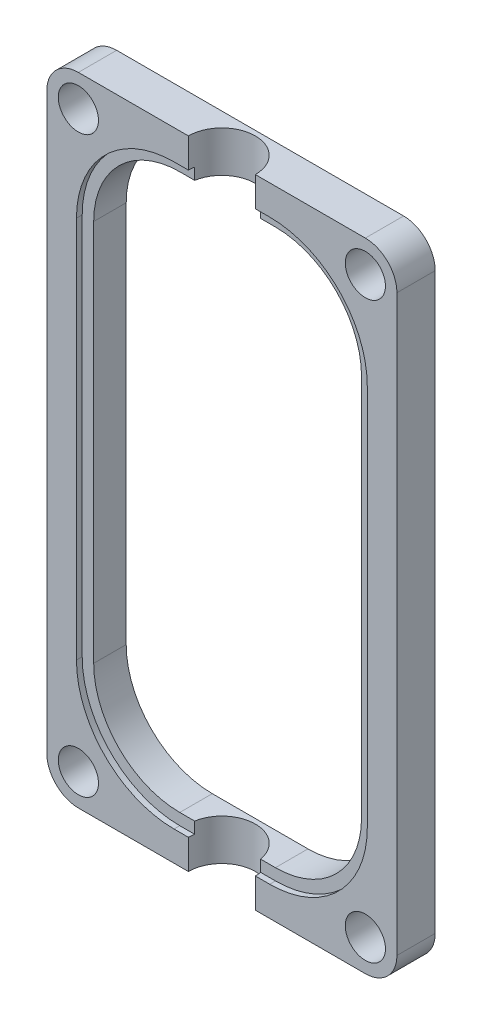
from build123d import *

# Parameters (mm, degrees)
SKIZZE1_R                       = 1.05
AUFSATZ_LINEAR_AUSTRAGEN1_DEPTH = 2
SCHNITT_LINEAR_AUSTRAGEN1_DEPTH = 0.3
SCHNITT_LINEAR_AUSTRAGEN2_REACH = 36.592


with BuildPart() as part:
    # Skizze1 → Aufsatz-Linear austragen1 (new body)
    with BuildSketch(Plane(origin=(0, 0, 0), x_dir=(0, 1, 0), z_dir=(0, 0, 1))):
        with BuildLine():
            Line((-16.65, 7.5), (-16.65, -7.5))
            ThreePointArc((-16.65, -7.5), (-16.166726189, -8.666726189), (-15, -9.15))
            Line((-15, -9.15), (15, -9.15))
            ThreePointArc((15, -9.15), (16.166726189, -8.666726189), (16.65, -7.5))
            Line((16.65, -7.5), (16.65, 7.5))
            ThreePointArc((16.65, 7.5), (16.166726189, 8.666726189), (15, 9.15))
            Line((15, 9.15), (-15, 9.15))
            ThreePointArc((-15, 9.15), (-16.166726189, 8.666726189), (-16.65, 7.5))
        make_face()
        with Locations(Location((-15, 7.5, 0), (0, 0, 270))):
            Circle(SKIZZE1_R, mode=Mode.SUBTRACT)
        with Locations(Location((15, 7.5, 0), (0, 0, 270))):
            Circle(SKIZZE1_R, mode=Mode.SUBTRACT)
        with Locations(Location((15, -7.5, 0), (0, 0, 270))):
            Circle(SKIZZE1_R, mode=Mode.SUBTRACT)
        with Locations(Location((-15, -7.5, 0), (0, 0, 270))):
            Circle(SKIZZE1_R, mode=Mode.SUBTRACT)
        with BuildLine():
            Line((-14.5, 2.5), (-14.5, -2.5))
            ThreePointArc((-14.5, -2.5), (-13.181980515, -5.681980515), (-10, -7))
            Line((-10, -7), (10, -7))
            ThreePointArc((10, -7), (13.181980515, -5.681980515), (14.5, -2.5))
            Line((14.5, -2.5), (14.5, 2.5))
            ThreePointArc((14.5, 2.5), (13.181980515, 5.681980515), (10, 7))
            Line((10, 7), (-10, 7))
            ThreePointArc((-10, 7), (-13.181980515, 5.681980515), (-14.5, 2.5))
        make_face(mode=Mode.SUBTRACT)
    extrude(amount=AUFSATZ_LINEAR_AUSTRAGEN1_DEPTH)

    # Skizze2 → Schnitt-Linear austragen1 (cut)
    with BuildSketch(Plane.XY.offset(2)):
        with BuildLine():
            Line((-2.5, -15.1), (2.5, -15.1))
            ThreePointArc((2.5, -15.1), (6.106244584, -13.606244584), (7.6, -10))
            Line((7.6, -10), (7.6, 10))
            ThreePointArc((7.6, 10), (6.106244584, 13.606244584), (2.5, 15.1))
            Line((2.5, 15.1), (-2.5, 15.1))
            ThreePointArc((-2.5, 15.1), (-6.106244584, 13.606244584), (-7.6, 10))
            Line((-7.6, 10), (-7.6, -10))
            ThreePointArc((-7.6, -10), (-6.106244584, -13.606244584), (-2.5, -15.1))
        make_face()
    extrude(amount=-SCHNITT_LINEAR_AUSTRAGEN1_DEPTH, mode=Mode.SUBTRACT)

    # Schnitt-Linear austragen2: up to this face of the body (flat: up to its plane)
    schnitt_linear_austragen2_end = Plane(part.part.faces().sort_by_distance((0, 16.65, 1))[0])
    # Skizze3 → Schnitt-Linear austragen2 (cut, up to the picked face)
    with BuildSketch(Plane.XZ.offset(16.65), mode=Mode.PRIVATE) as schnitt_linear_austragen2_sk1:
        with BuildLine():
            Line((-1.75, 2), (1.75, 2))
            ThreePointArc((1.75, 2), (0, 0.25), (-1.75, 2))
        make_face()
    schnitt_linear_austragen2_tool1 = split(extrude(schnitt_linear_austragen2_sk1.sketch, amount=-SCHNITT_LINEAR_AUSTRAGEN2_REACH, mode=Mode.PRIVATE), bisect_by=schnitt_linear_austragen2_end, keep=Keep.BOTH, mode=Mode.PRIVATE)
    add(schnitt_linear_austragen2_tool1.solids().sort_by(Axis((0, -16.65, 1.257277), (0, 1, 0)))[0], mode=Mode.SUBTRACT)


solid = part.part
